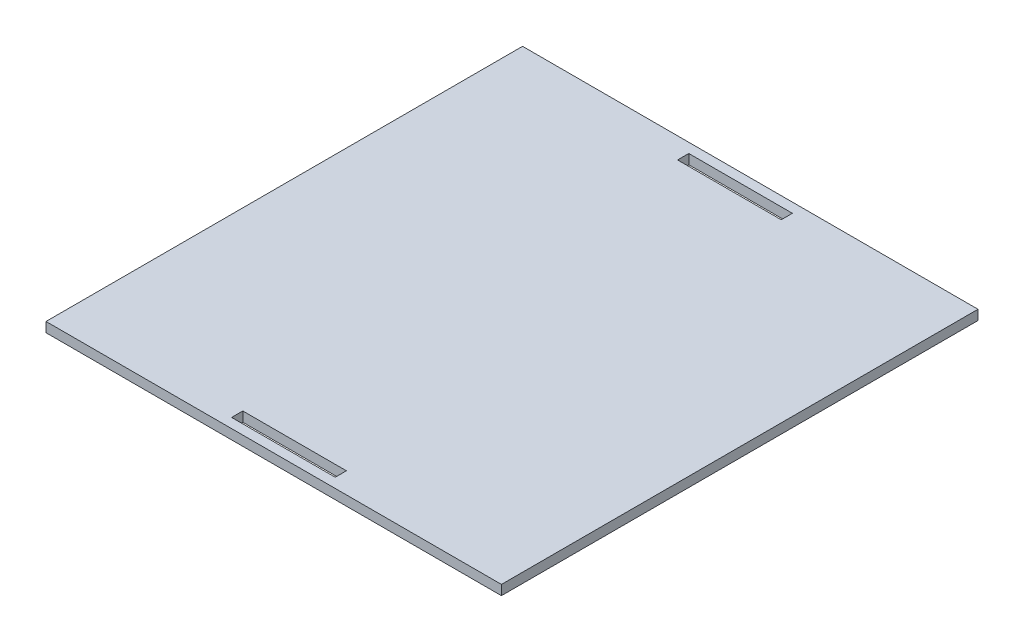
from build123d import *

# Parameters (mm, degrees)
SKETCH1_W           = 139.573
SKETCH1_H           = 146.05
SKETCH1_W_2         = 31.75
SKETCH1_H_2         = 3.429
BOSS_EXTRUDE1_DEPTH = 2.9972


with BuildPart() as part:
    # Sketch1 → Boss-Extrude1 (new body)
    with BuildSketch(Plane(origin=(0, 0, 0), x_dir=(1, 0, 0), z_dir=(0, 1, 0))):
        Rectangle(SKETCH1_W, SKETCH1_H)
        with Locations((0, 68.3387)):
            Rectangle(SKETCH1_W_2, SKETCH1_H_2, mode=Mode.SUBTRACT)
        with Locations((0, -68.3387)):
            Rectangle(SKETCH1_W_2, SKETCH1_H_2, mode=Mode.SUBTRACT)
    extrude(amount=BOSS_EXTRUDE1_DEPTH)


solid = part.part
